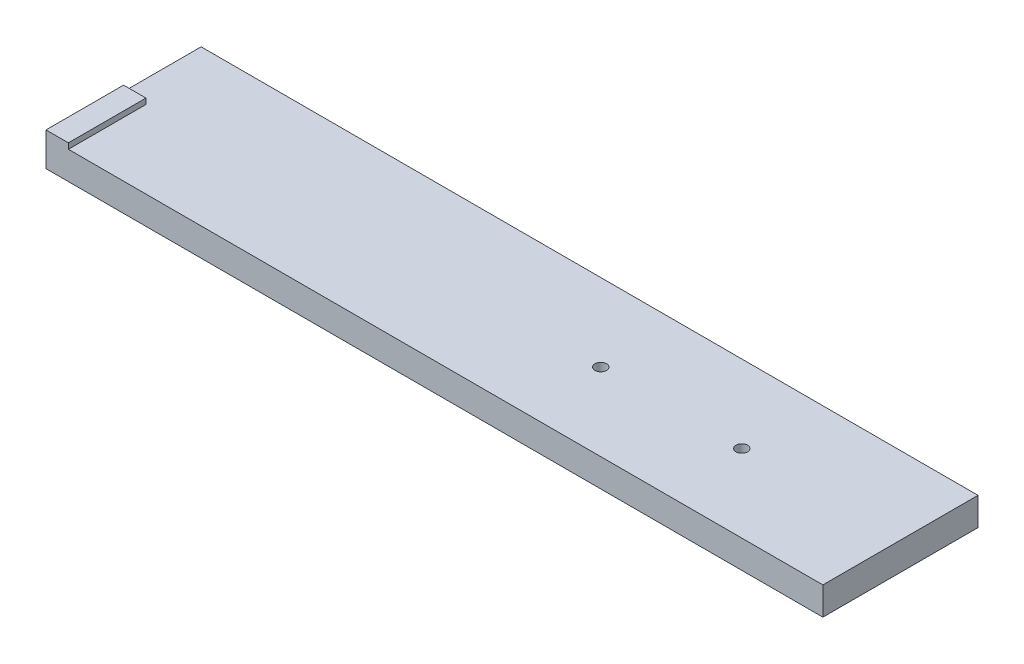
from build123d import *

# Parameters (mm, degrees)
SKETCH1_W             = 220.35
SKETCH1_H             = 44
BOSS_EXTRUDE1_DEPTH   = 7.9375
SKETCH2_W             = 6.35
SKETCH2_H             = 22
BOSS_EXTRUDE2_DEPTH   = 1.5875
M4X0_7_TAPPED_HOLE2_D = 3.3


with BuildPart() as part:
    # Sketch1 → Boss-Extrude1 (new body)
    with BuildSketch(Plane(origin=(0, 0, 0), x_dir=(1, 0, 0), z_dir=(0, 1, 0))):
        with Locations((110.175, 22)):
            Rectangle(SKETCH1_W, SKETCH1_H)
    extrude(amount=BOSS_EXTRUDE1_DEPTH)

    # Sketch2 → Boss-Extrude2 (add)
    with BuildSketch(Plane(origin=(0, 7.9375, 0), x_dir=(1, 0, 0), z_dir=(0, 1, 0))):
        with Locations((3.175, 11)):
            Rectangle(SKETCH2_W, SKETCH2_H)
    extrude(amount=BOSS_EXTRUDE2_DEPTH)

    # M4x0.7 Tapped Hole2 (through all)
    with Locations(Plane(origin=(0, 7.9375, 0), x_dir=(1, 0, 0), z_dir=(0, 1, 0))):
        with Locations((135.35, 22), (175.35, 22)):
            Hole(M4X0_7_TAPPED_HOLE2_D / 2)


solid = part.part
